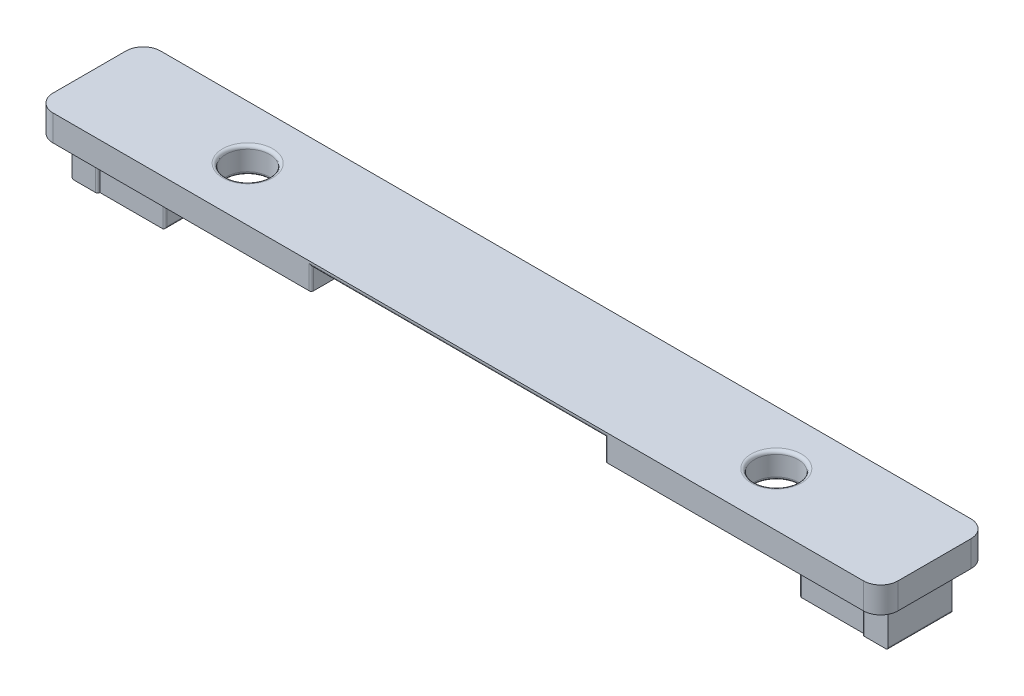
from build123d import *
from OCP.BRepFilletAPI import BRepFilletAPI_MakeFillet

# Parameters (mm, degrees)
SKETCH1_W             = 195
SKETCH1_H             = 24.8
SKETCH1_R             = 5.05
BOSS_EXTRUDE1_DEPTH   = 6
CUT_EXTRUDE1_DEPTH    = 33.9
FILLET1_R1            = 0.75
FILLET1_R2            = 4
FILLET1_R3            = 0.5
BOSS_EXTRUDE2_DEPTH   = 10
FILLET2_R1            = 3
FILLET2_R2            = 0.5
SKETCH5_W             = 13.8
SKETCH5_H             = 4.9
BOSS_EXTRUDE4_DEPTH   = 15
FILLET3_R             = 0.5
FILLET2_OF_MIRROR2_R1 = 3
FILLET2_OF_MIRROR2_R2 = 0.5
FILLET3_OF_MIRROR2_R  = 0.5


with BuildPart() as part:
    # Sketch1 → Boss-Extrude1 (new body)
    with BuildSketch(Plane(origin=(0, 0, 0), x_dir=(1, 0, 0), z_dir=(0, 1, 0))):
        Rectangle(SKETCH1_W, SKETCH1_H)
        with Locations(Location((-61, 0, 0), (0, 0, 270))):
            Circle(SKETCH1_R, mode=Mode.SUBTRACT)
        with Locations(Location((61, 0, 0), (0, 0, 270))):
            Circle(SKETCH1_R, mode=Mode.SUBTRACT)
    extrude(amount=BOSS_EXTRUDE1_DEPTH)

    # Sketch2 → Cut-Extrude1 (cut, symmetric)
    with BuildSketch(Plane(origin=(0, 0, 0), x_dir=(0, 0, -1), z_dir=(1, 0, 0))):
        with BuildLine():
            Line((-12.4, 0), (-12.4, 5))
            add(Edge.make_bspline(
                [(7.5, 0), (7.5, 5), (-12.4, 5)],
                knots=[3.141592654, 3.141592654, 3.141592654, 4.71238898, 4.71238898, 4.71238898], degree=2, weights=[1, 0.707106781, 1]))
            Line((7.5, 0), (-12.4, 0))
        make_face()
    extrude(amount=CUT_EXTRUDE1_DEPTH, both=True, mode=Mode.SUBTRACT)

    # Fillet1: one fillet with a radius per group of edges: ONE call of the kernel's fillet builder (fillet() takes one radius for all edges)
    fillet1_edges_1 = [part.edges().sort_by_distance(p)[0] for p in [
        (-61, 0, -5.05),
        (-61, 6, -5.05),
        (61, 0, -5.05),
        (61, 6, -5.05),
    ]]
    fillet1_edges_2 = [part.edges().sort_by_distance(p)[0] for p in [
        (97.5, 3, 12.4),
        (-97.5, 3, 12.4),
        (-97.5, 3, -12.4),
        (97.5, 3, -12.4),
    ]]
    fillet1_edges_3 = [part.edges().sort_by_distance(p)[0] for p in [
        (-33.9, 2.5, 12.4),
        (16.95, 5, 12.4),
        (33.9, 2.5, 12.4),
    ]]
    fillet1 = BRepFilletAPI_MakeFillet(part.part.solid().wrapped)
    for e in fillet1_edges_1:
        fillet1.Add(FILLET1_R1, e.wrapped)
    for e in fillet1_edges_2:
        fillet1.Add(FILLET1_R2, e.wrapped)
    for e in fillet1_edges_3:
        fillet1.Add(FILLET1_R3, e.wrapped)
    add(Compound.cast(fillet1.Shape()), mode=Mode.REPLACE)

    # Sketch3 → Boss-Extrude2 (add)
    with BuildSketch(Plane.XZ):
        with BuildLine():
            Line((88.7, -7.4), (94.2, -7.4))
            Line((94.2, -7.4), (94.2, 7.4))
            Line((94.2, 7.4), (88.7, 7.4))
            ThreePointArc((88.7, 7.4), (88.346446609, 7.253553391), (88.2, 6.9))
            Line((88.2, 6.9), (88.2, -6.9))
            ThreePointArc((88.2, -6.9), (88.346446609, -7.253553391), (88.7, -7.4))
        make_face()
    boss_extrude2 = extrude(amount=BOSS_EXTRUDE2_DEPTH)

    # Fillet2: one fillet with a radius per group of edges: ONE call of the kernel's fillet builder (fillet() takes one radius for all edges)
    fillet2_edges_1 = [part.edges().sort_by_distance(p)[0] for p in [
        (94.2, 0, 0),
    ]]
    fillet2_edges_2 = [part.edges().sort_by_distance(p)[0] for p in [
        (94.2, -10, 0),
    ]]
    fillet2 = BRepFilletAPI_MakeFillet(part.part.solid().wrapped)
    for e in fillet2_edges_1:
        fillet2.Add(FILLET2_R1, e.wrapped)
    for e in fillet2_edges_2:
        fillet2.Add(FILLET2_R2, e.wrapped)
    add(Compound.cast(fillet2.Shape()), mode=Mode.REPLACE)

    # Sketch5 → Boss-Extrude4 (add)
    with BuildSketch(Plane.ZY.offset(-88.2)):
        with Locations((0, -7.55)):
            Rectangle(SKETCH5_W, SKETCH5_H)
    boss_extrude4 = extrude(amount=BOSS_EXTRUDE4_DEPTH)

    # Fillet3
    fillet3_edges = [part.edges().sort_by_distance(p)[0] for p in [
        (73.2, -7.55, -6.9),
        (73.2, -10, 0),
        (73.2, -7.55, 6.9),
        (73.2, -5.1, 0),
    ]]
    fillet(fillet3_edges, radius=FILLET3_R)

    # Mirror2: Boss-Extrude2, Boss-Extrude4 across plane
    add(boss_extrude2.mirror(Plane(origin=(0, 0, 0), x_dir=(0, 0, 1), z_dir=(1, 0, 0))))
    add(boss_extrude4.mirror(Plane(origin=(0, 0, 0), x_dir=(0, 0, 1), z_dir=(1, 0, 0))))

    # Fillet2 of Mirror2: one fillet with a radius per group of edges: ONE call of the kernel's fillet builder (fillet() takes one radius for all edges)
    fillet2_of_mirror2_edges_1 = [part.edges().sort_by_distance(p)[0] for p in [
        (-94.2, 0, 0),
    ]]
    fillet2_of_mirror2_edges_2 = [part.edges().sort_by_distance(p)[0] for p in [
        (-94.2, -10, 0),
    ]]
    fillet2_of_mirror2 = BRepFilletAPI_MakeFillet(part.part.solid().wrapped)
    for e in fillet2_of_mirror2_edges_1:
        fillet2_of_mirror2.Add(FILLET2_OF_MIRROR2_R1, e.wrapped)
    for e in fillet2_of_mirror2_edges_2:
        fillet2_of_mirror2.Add(FILLET2_OF_MIRROR2_R2, e.wrapped)
    add(Compound.cast(fillet2_of_mirror2.Shape()), mode=Mode.REPLACE)

    # Fillet3 of Mirror2
    fillet3_of_mirror2_edges = [part.edges().sort_by_distance(p)[0] for p in [
        (-73.2, -7.55, -6.9),
        (-73.2, -10, 0),
        (-73.2, -7.55, 6.9),
        (-73.2, -5.1, 0),
    ]]
    fillet(fillet3_of_mirror2_edges, radius=FILLET3_OF_MIRROR2_R)


solid = part.part
